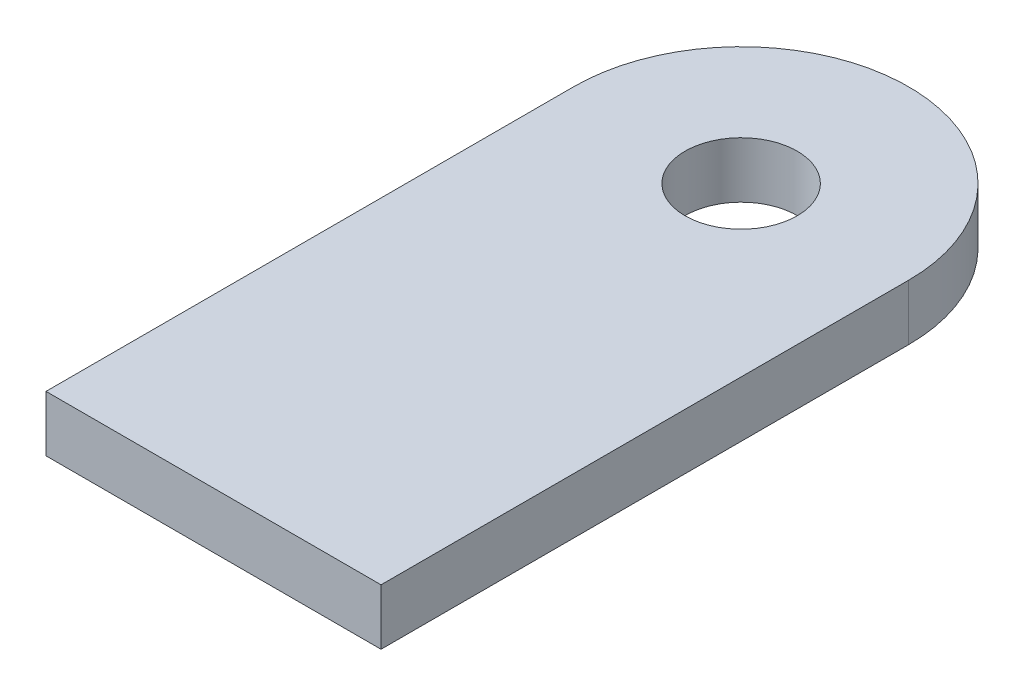
from build123d import *

# Parameters (mm, degrees)
SKETCH1_R           = 4.25
BOSS_EXTRUDE1_DEPTH = 4.233333333


with BuildPart() as part:
    # Sketch1 → Boss-Extrude1 (new body)
    with BuildSketch(Plane(origin=(0, 0, 0), x_dir=(1, 0, 0), z_dir=(0, 1, 0))):
        with BuildLine():
            Line((0, 0), (25.4, 0))
            Line((25.4, 0), (25.4, 40))
            ThreePointArc((25.4, 40), (12.7, 52.7), (0, 40))
            Line((0, 40), (0, 0))
        make_face()
        with Locations(Location((12.7, 40, 0), (0, 0, 270))):
            Circle(SKETCH1_R, mode=Mode.SUBTRACT)
    extrude(amount=BOSS_EXTRUDE1_DEPTH)


solid = part.part
